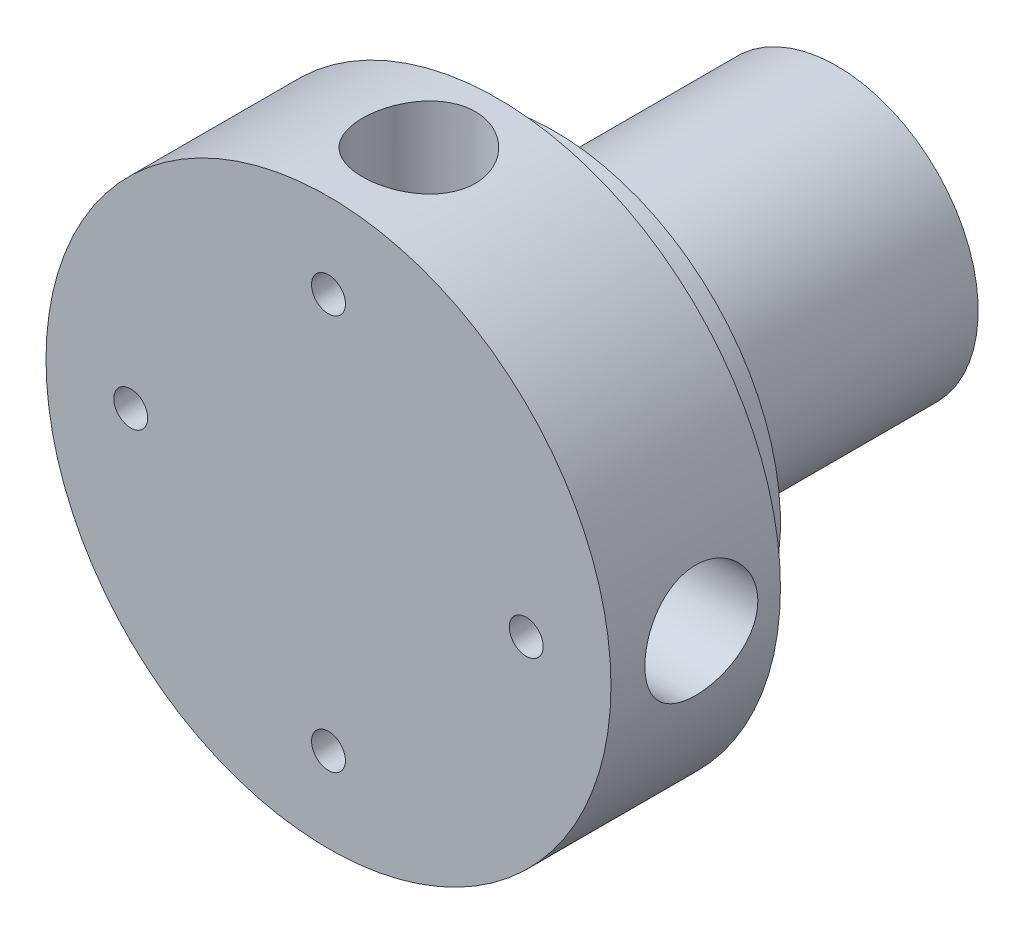
from build123d import *

# Parameters (mm, degrees)
SKETCH1_R           = 25
BOSS_EXTRUDE1_DEPTH = 15
CUT_EXTRUDE1_START  = -10
SKETCH2_R           = 5
CUT_EXTRUDE1_DEPTH  = 60
SKETCH8_R           = 20
BOSS_EXTRUDE4_DEPTH = 5
SKETCH3_R           = 1.5
CUT_EXTRUDE2_DEPTH  = 20
CIRPATTERN2_COUNT   = 4
SKETCH4_R           = 12.5
BOSS_EXTRUDE2_DEPTH = 30
CUT_EXTRUDE4_START  = -5
SKETCH7_R           = 1.5
CUT_EXTRUDE4_DEPTH  = 15
FILLET3_R           = 2


with BuildPart() as part:
    # Sketch1 → Boss-Extrude1 (new body)
    with BuildSketch(Plane.XY):
        Circle(SKETCH1_R)
    extrude(amount=BOSS_EXTRUDE1_DEPTH)

    # Sketch2 → Cut-Extrude1 (cut)
    with BuildSketch(Plane(origin=(0, 0, 0), x_dir=(1, 0, 0), z_dir=(0, 1, 0)).offset(CUT_EXTRUDE1_START)):
        with Locations(Location((0, -7, 0), (0, 0, 270))):
            Circle(SKETCH2_R)
    cut_extrude1 = extrude(amount=-CUT_EXTRUDE1_DEPTH, mode=Mode.SUBTRACT)

    # Sketch8 → Boss-Extrude4 (add)
    with BuildSketch(Plane(origin=(0, 0, 0), x_dir=(-1, 0, 0), z_dir=(0, 0, -1))):
        Circle(SKETCH8_R)
    extrude(amount=BOSS_EXTRUDE4_DEPTH)

    # Sketch3 → Cut-Extrude2 (cut)
    with BuildSketch(Plane.XY.offset(15)):
        with Locations((0, -17.5)):
            Circle(SKETCH3_R)
    cut_extrude2 = extrude(amount=-CUT_EXTRUDE2_DEPTH, mode=Mode.SUBTRACT)

    # CirPattern2: Cut-Extrude1, Cut-Extrude2 ×4 about axis
    cirpattern2_axis = Axis((0, 0, 0), (0, 0, 1))
    add([cut_extrude1.rotate(cirpattern2_axis, i * 360 / CIRPATTERN2_COUNT) for i in range(1, CIRPATTERN2_COUNT)], mode=Mode.SUBTRACT)
    add([cut_extrude2.rotate(cirpattern2_axis, i * 360 / CIRPATTERN2_COUNT) for i in range(1, CIRPATTERN2_COUNT)], mode=Mode.SUBTRACT)

    # Sketch4 → Boss-Extrude2 (add)
    with BuildSketch(Plane(origin=(0, 0, 0), x_dir=(-1, 0, 0), z_dir=(0, 0, -1))):
        Circle(SKETCH4_R)
    extrude(amount=BOSS_EXTRUDE2_DEPTH)

    # Sketch7 → Cut-Extrude4 (cut)
    with BuildSketch(Plane(origin=(0, 0, 0), x_dir=(0, 0, -1), z_dir=(1, 0, 0)).offset(CUT_EXTRUDE4_START)):
        with Locations((27, 0)):
            Circle(SKETCH7_R)
    extrude(amount=-CUT_EXTRUDE4_DEPTH, mode=Mode.SUBTRACT)

    # Fillet3
    fillet3_edges = [part.edges().sort_by_distance(p)[0] for p in [
        (12.5, 0, -5),
    ]]
    fillet(fillet3_edges, radius=FILLET3_R)


solid = part.part
